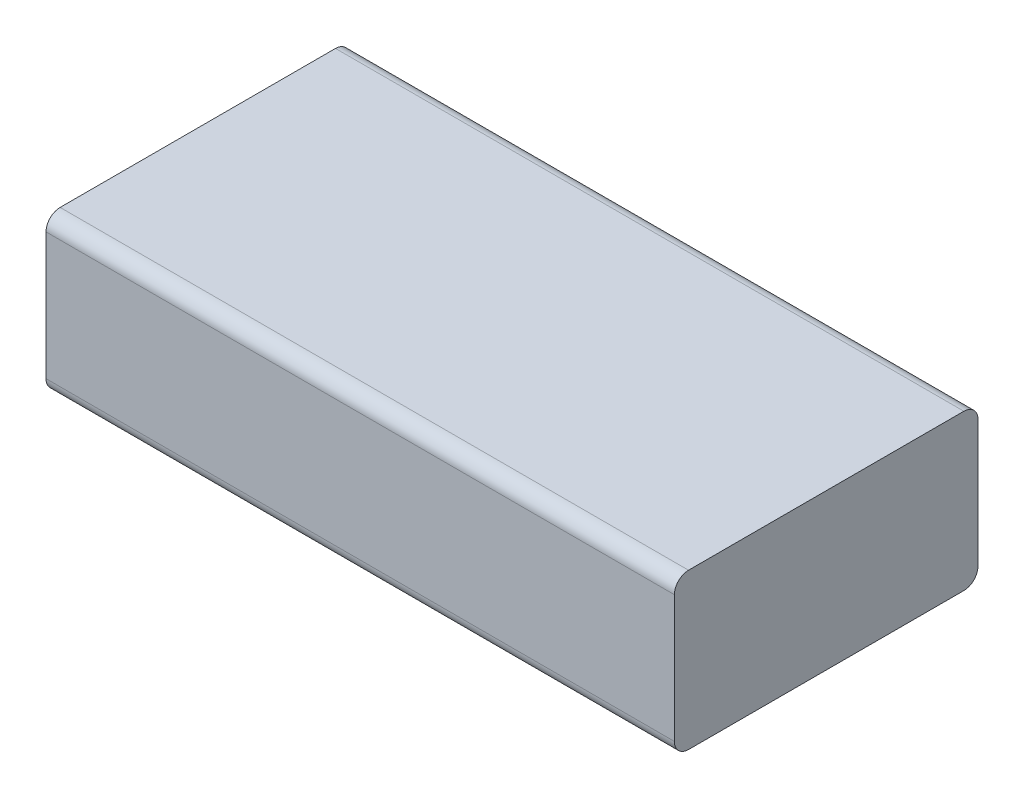
from build123d import *

# Parameters (mm, degrees)
SKETCH1_W           = 89
SKETCH1_H           = 43
BOSS_EXTRUDE1_DEPTH = 22
FILLET1_R           = 2


with BuildPart() as part:
    # Sketch1 → Boss-Extrude1 (new body)
    with BuildSketch(Plane(origin=(0, 0, 0), x_dir=(1, 0, 0), z_dir=(0, 1, 0))):
        Rectangle(SKETCH1_W, SKETCH1_H)
    extrude(amount=BOSS_EXTRUDE1_DEPTH)

    # Fillet1
    fillet1_edges = [part.edges().sort_by_distance(p)[0] for p in [
        (0, 22, -21.5),
        (0, 0, -21.5),
        (0, 0, 21.5),
        (0, 22, 21.5),
    ]]
    fillet(fillet1_edges, radius=FILLET1_R)


solid = part.part
